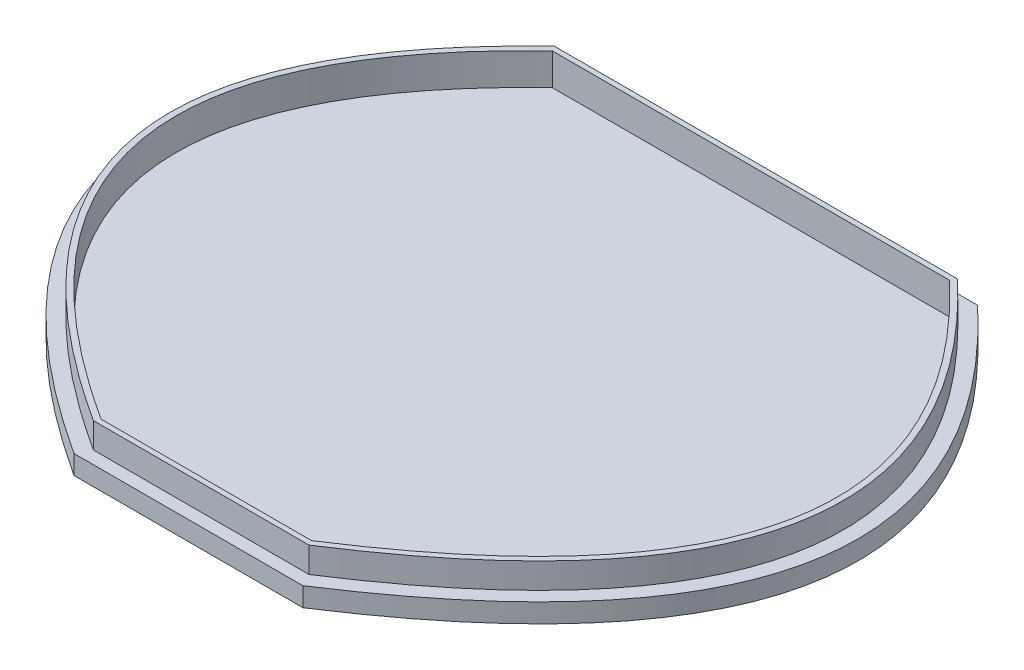
from build123d import *

# Parameters (mm, degrees)
BOSS_EXTRUDE6_DEPTH = 1.27
BOSS_EXTRUDE7_DEPTH = 0.635
BOSS_EXTRUDE8_DEPTH = 2.54


with BuildPart() as part:
    # Sketch1 → Boss-Extrude6 (new body)
    with BuildSketch(Plane(origin=(0, 0, 0), x_dir=(1, 0, 0), z_dir=(0, 1, 0))):
        with BuildLine():
            Line((-9.304269575, -27.345620797), (13.511541223, -27.345620797))
            add(Edge.make_bspline(
                [(22.920452389, 30.489026504), (55.478836557, -0.15547818), (13.511541223, -27.345620797)],
                knots=[0, 0, 0, 1, 1, 1], degree=2))
            Line((22.920452389, 30.489026504), (-18.713180741, 30.489026504))
            add(Edge.make_bspline(
                [(-18.713180741, 30.489026504), (-51.271564909, -0.15547818), (-9.304269575, -27.345620797)],
                knots=[0, 0, 0, 1, 1, 1], degree=2))
        make_face()
    extrude(amount=BOSS_EXTRUDE6_DEPTH)

    # Sketch2 → Boss-Extrude7 (add)
    # profile 1 of 2: a face of its own
    with BuildSketch(Plane(origin=(0, 1.27, 0), x_dir=(1, 0, 0), z_dir=(0, 1, 0))):
        with BuildLine():
            Line((-9.304269575, -27.345620797), (13.511541223, -27.345620797))
            add(Edge.make_bspline(
                [(13.511541223, -27.345620797), (55.478836557, -0.15547818), (22.920452389, 30.489026504)],
                knots=[0, 0, 0, 1, 1, 1], degree=2))
            Line((22.920452389, 30.489026504), (-18.713180741, 30.489026504))
            add(Edge.make_bspline(
                [(-18.713180741, 30.489026504), (-51.271564909, -0.15547818), (-9.304269575, -27.345620797)],
                knots=[0, 0, 0, 1, 1, 1], degree=2))
        make_face()
        with BuildLine():
            Line((-17.979945899, 29.219026504), (22.187217547, 29.219026504))
            add(Edge.make_bspline(
                [(22.187217547, 29.219026504), (53.157284404, -0.080086004), (12.854748908, -26.075620797)],
                knots=[0, 0, 0, 1, 1, 1], degree=2))
            Line((12.854748908, -26.075620797), (-8.64747726, -26.075620797))
            add(Edge.make_bspline(
                [(-17.979945899, 29.219026504), (-48.950012756, -0.080086004), (-8.64747726, -26.075620797)],
                knots=[0, 0, 0, 1, 1, 1], degree=2))
        make_face(mode=Mode.SUBTRACT)
    # profile 2 of 2: a face of its own
    with BuildSketch(Plane(origin=(0, 1.27, 0), x_dir=(1, 0, 0), z_dir=(0, 1, 0))):
        with BuildLine():
            add(Edge.make_bspline(
                [(22.187217547, 29.219026504), (53.157284404, -0.080086004), (12.854748908, -26.075620797)],
                knots=[0, 0, 0, 1, 1, 1], degree=2))
            Line((12.854748908, -26.075620797), (-8.64747726, -26.075620797))
            add(Edge.make_bspline(
                [(-17.979945899, 29.219026504), (-48.950012756, -0.080086004), (-8.64747726, -26.075620797)],
                knots=[0, 0, 0, 1, 1, 1], degree=2))
            Line((-17.979945899, 29.219026504), (22.187217547, 29.219026504))
        make_face()
        with BuildLine():
            Line((-17.686651962, 28.711026504), (21.89392361, 28.711026504))
            add(Edge.make_bspline(
                [(21.89392361, 28.711026504), (52.228663543, -0.049929134), (12.592031982, -25.567620797)],
                knots=[0, 0, 0, 1, 1, 1], degree=2))
            Line((12.592031982, -25.567620797), (-8.384760334, -25.567620797))
            add(Edge.make_bspline(
                [(-17.686651962, 28.711026504), (-48.021391895, -0.049929134), (-8.384760334, -25.567620797)],
                knots=[0, 0, 0, 1, 1, 1], degree=2))
        make_face(mode=Mode.SUBTRACT)
    extrude(amount=BOSS_EXTRUDE7_DEPTH)

    # Sketch3 → Boss-Extrude8 (add)
    with BuildSketch(Plane(origin=(0, 1.905, 0), x_dir=(1, 0, 0), z_dir=(0, 1, 0))):
        with BuildLine():
            Line((22.187217547, 29.219026504), (-17.979945899, 29.219026504))
            add(Edge.make_bspline(
                [(-17.979945899, 29.219026504), (-48.950012756, -0.080086004), (-8.64747726, -26.075620797)],
                knots=[0, 0, 0, 1, 1, 1], degree=2))
            Line((-8.64747726, -26.075620797), (12.854748908, -26.075620797))
            add(Edge.make_bspline(
                [(22.187217547, 29.219026504), (53.157284404, -0.080086004), (12.854748908, -26.075620797)],
                knots=[0, 0, 0, 1, 1, 1], degree=2))
        make_face()
        with BuildLine():
            Line((-17.686651962, 28.711026504), (21.89392361, 28.711026504))
            add(Edge.make_bspline(
                [(12.592031982, -25.567620797), (52.228663543, -0.049929134), (21.89392361, 28.711026504)],
                knots=[0, 0, 0, 1, 1, 1], degree=2))
            Line((12.592031982, -25.567620797), (-8.384760334, -25.567620797))
            add(Edge.make_bspline(
                [(-17.686651962, 28.711026504), (-48.021391895, -0.049929134), (-8.384760334, -25.567620797)],
                knots=[0, 0, 0, 1, 1, 1], degree=2))
        make_face(mode=Mode.SUBTRACT)
    extrude(amount=BOSS_EXTRUDE8_DEPTH)


solid = part.part
